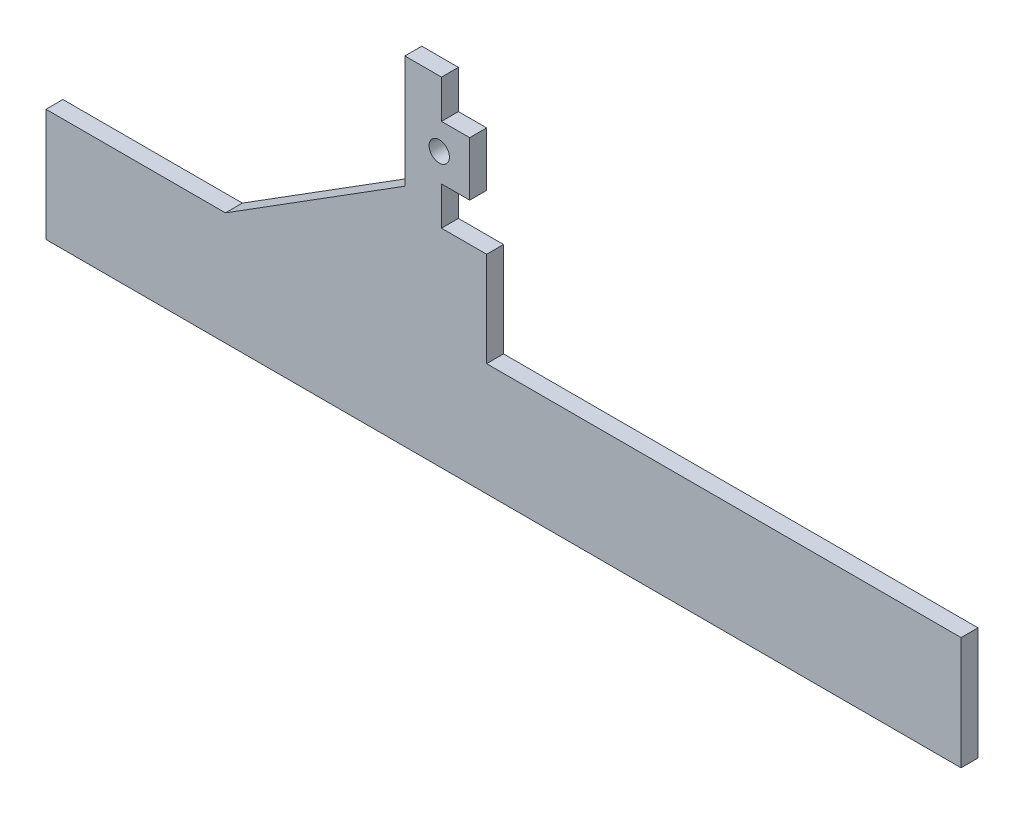
from build123d import *

# Parameters (mm, degrees)
CROQUIS1_R              = 9
SALIENTE_EXTRUIR1_DEPTH = 15


with BuildPart() as part:
    # Croquis1 → Saliente-Extruir1 (new body)
    with BuildSketch(Plane.XY):
        Polygon((-15, 50), (-15, 134), (-55, 134), (-55, 168), (-30, 168), (-30, 216), (-55, 216), (-55, 250), (-87.48, 250), (-87.48, 150), (-246.54, 50), (-405.6, 50), (-405.6, -50), (405.6, -50), (405.6, 50), align=None)
        with Locations((-56.98, 192)):
            Circle(CROQUIS1_R, mode=Mode.SUBTRACT)
    extrude(amount=SALIENTE_EXTRUIR1_DEPTH)


solid = part.part
